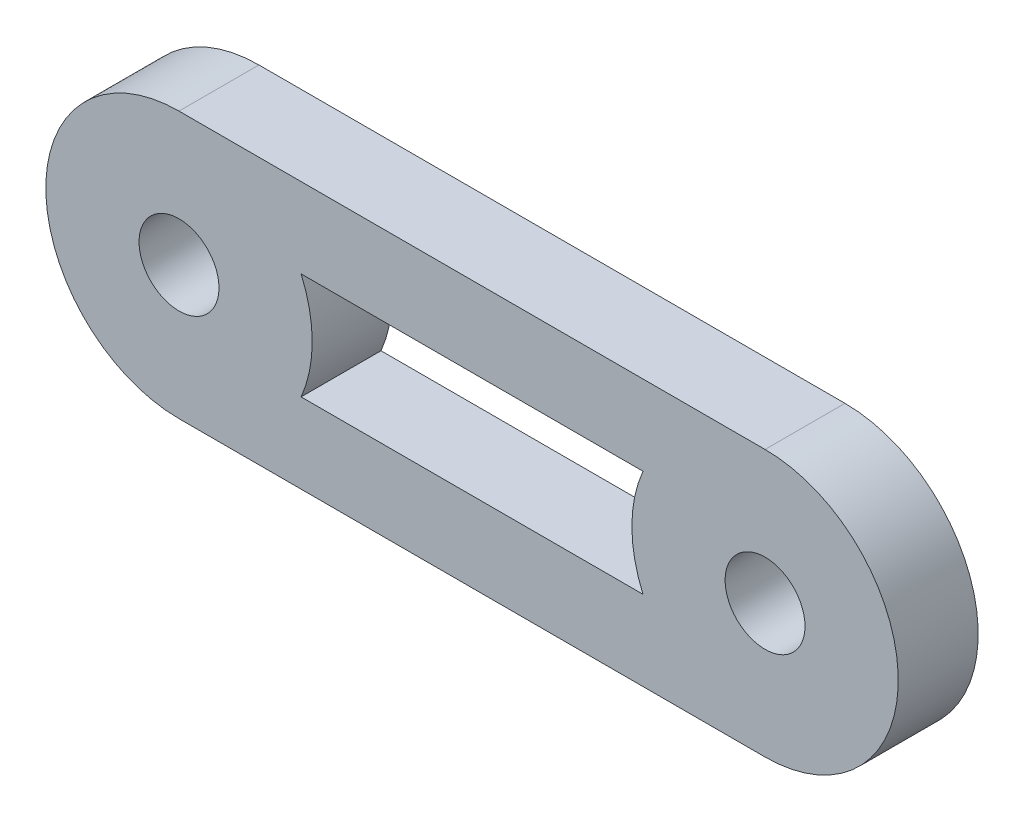
from build123d import *

# Parameters (mm, degrees)
SKETCH1_R          = 1.5
EXTRUDE1_DEPTH     = 3
CUT_EXTRUDE1_START = -10
CUT_EXTRUDE1_DEPTH = 10


with BuildPart() as part:
    # Sketch1 → Extrude1 (new body)
    with BuildSketch(Plane.XY):
        with BuildLine():
            Line((0, -5), (22, -5))
            ThreePointArc((22, -5), (27, 0), (22, 5))
            Line((22, 5), (0, 5))
            ThreePointArc((0, 5), (-5, 0), (0, -5))
        make_face()
        with Locations((22, 0)):
            Circle(SKETCH1_R, mode=Mode.SUBTRACT)
        Circle(SKETCH1_R, mode=Mode.SUBTRACT)
    extrude(amount=EXTRUDE1_DEPTH)

    # Sketch2 → Cut-Extrude1 (cut)
    with BuildSketch(Plane.XY.offset(3).offset(CUT_EXTRUDE1_START)):
        with BuildLine():
            Line((4.582575695, -2), (17.417424305, -2))
            ThreePointArc((17.417424305, -2), (17, 0), (17.417424305, 2))
            Line((17.417424305, 2), (4.582575695, 2))
            ThreePointArc((4.582575695, 2), (5, 0), (4.582575695, -2))
        make_face()
    extrude(amount=CUT_EXTRUDE1_DEPTH, mode=Mode.SUBTRACT)


solid = part.part
